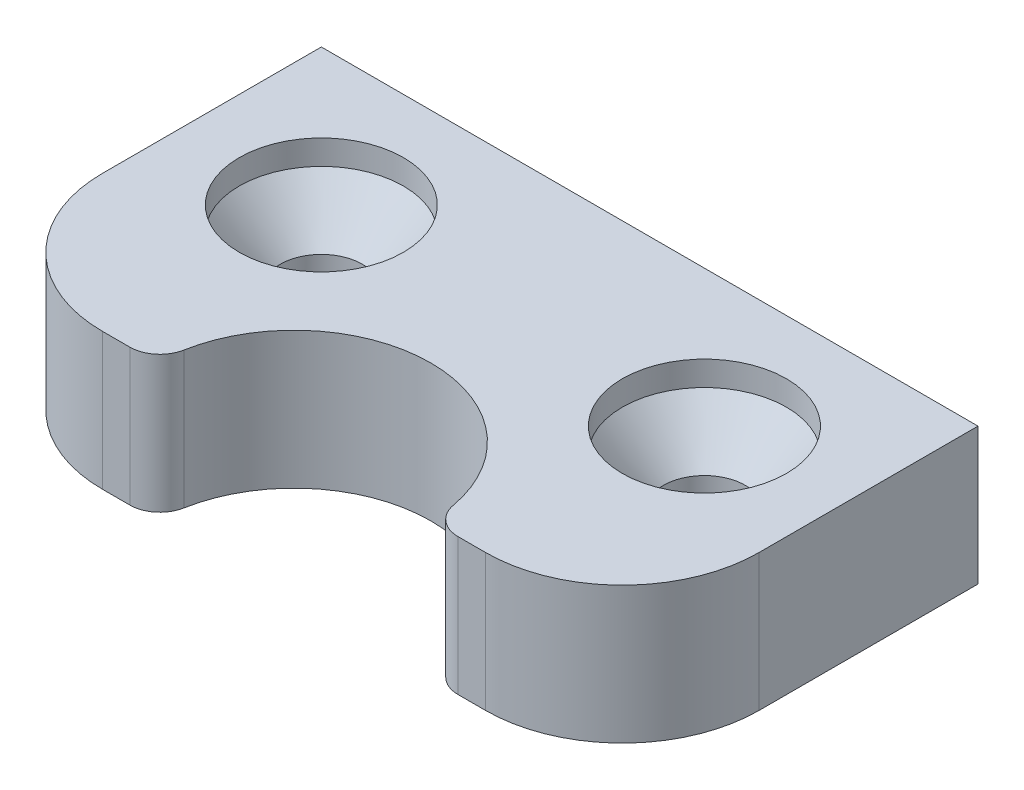
from build123d import *

# Parameters (mm, degrees)
SKETCH1_W                                         = 30.48
SKETCH1_H                                         = 16.51
BOSS_EXTRUDE1_DEPTH                               = 6.35
FILLET1_R                                         = 6.35
SKETCH2_R                                         = 6.35
CUT_EXTRUDE1_DEPTH                                = 12.7
FILLET2_R                                         = 1.397
SKETCH3_R                                         = 3.81
CUT_EXTRUDE2_DEPTH                                = 1.143
CSK_FOR_0_FLAT_HEAD_SOCKET_CAP_SCREW1_D           = 3.81
CSK_FOR_0_FLAT_HEAD_SOCKET_CAP_SCREW1_CSINK_D     = 7.62
CSK_FOR_0_FLAT_HEAD_SOCKET_CAP_SCREW1_CSINK_ANGLE = 82
SKETCH6_R                                         = 2.54
CUT_EXTRUDE3_DEPTH                                = 5.08


with BuildPart() as part:
    # Sketch1 → Boss-Extrude1 (new body)
    with BuildSketch(Plane(origin=(0, 0, 0), x_dir=(1, 0, 0), z_dir=(0, 1, 0))):
        with Locations((15.24, 8.255)):
            Rectangle(SKETCH1_W, SKETCH1_H)
    extrude(amount=BOSS_EXTRUDE1_DEPTH)

    # Fillet1
    fillet1_edges = [part.edges().sort_by_distance(p)[0] for p in [
        (30.48, 3.175, 0),
        (0, 3.175, 0),
    ]]
    fillet(fillet1_edges, radius=FILLET1_R)

    # Sketch2 → Cut-Extrude1 (cut)
    with BuildSketch(Plane(origin=(0, 6.35, 0), x_dir=(1, 0, 0), z_dir=(0, 1, 0))):
        with Locations((15.24, 0)):
            Circle(SKETCH2_R)
    extrude(amount=-CUT_EXTRUDE1_DEPTH, mode=Mode.SUBTRACT)

    # Fillet2
    fillet2_edges = [part.edges().sort_by_distance(p)[0] for p in [
        (8.89, 3.175, 0),
        (21.59, 3.175, 0),
    ]]
    fillet(fillet2_edges, radius=FILLET2_R)

    # Sketch3 → Cut-Extrude2 (cut)
    with BuildSketch(Plane(origin=(0, 6.35, 0), x_dir=(1, 0, 0), z_dir=(0, 1, 0))):
        with Locations(Location((6.35, 10.16, 0), (0, 0, 270))):
            Circle(SKETCH3_R)
        with Locations(Location((24.13, 10.16, 0), (0, 0, 270))):
            Circle(SKETCH3_R)
    extrude(amount=-CUT_EXTRUDE2_DEPTH, mode=Mode.SUBTRACT)

    # CSK for #0 Flat Head Socket Cap Screw1 (through all)
    with Locations(Plane(origin=(0, 5.207, 0), x_dir=(1, 0, 0), z_dir=(0, 1, 0))):
        with Locations((6.35, 10.16), (24.13, 10.16)):
            CounterSinkHole(CSK_FOR_0_FLAT_HEAD_SOCKET_CAP_SCREW1_D / 2, CSK_FOR_0_FLAT_HEAD_SOCKET_CAP_SCREW1_CSINK_D / 2, counter_sink_angle=CSK_FOR_0_FLAT_HEAD_SOCKET_CAP_SCREW1_CSINK_ANGLE)

    # Sketch6 → Cut-Extrude3 (cut)
    with BuildSketch(Plane.XZ):
        with Locations(Location((15.24, -10.16, 0), (0, 0, 270))):
            Circle(SKETCH6_R)
    extrude(amount=-CUT_EXTRUDE3_DEPTH, mode=Mode.SUBTRACT)


solid = part.part
